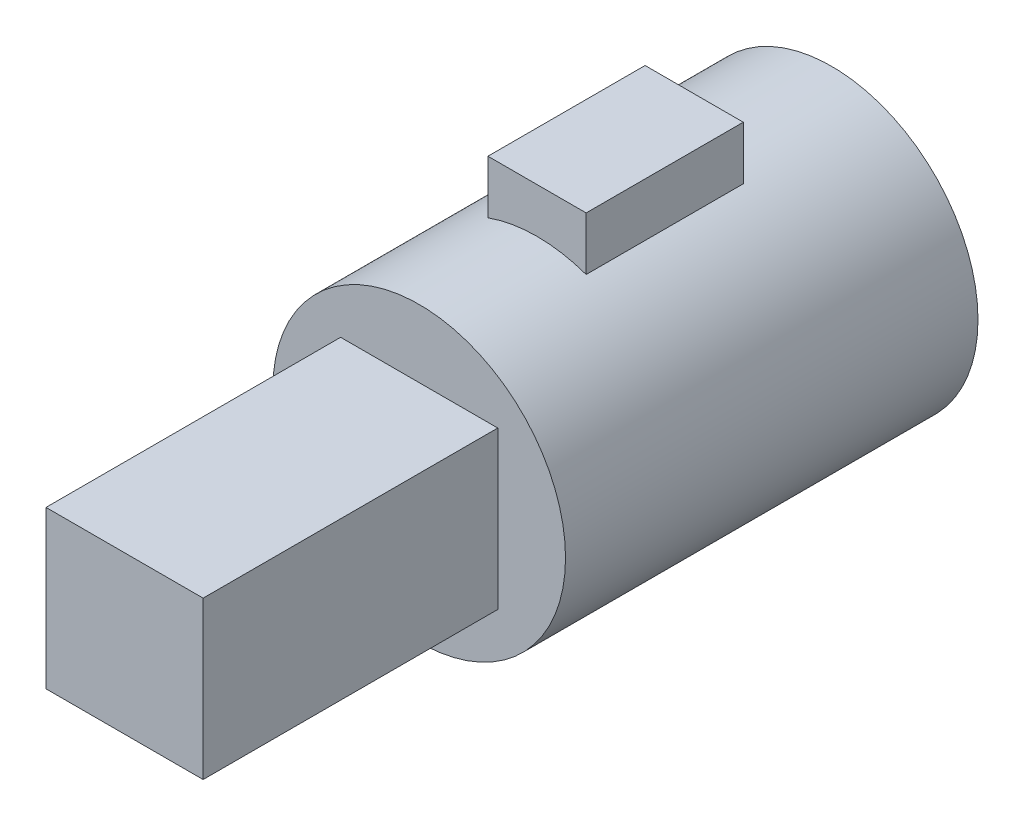
from build123d import *

# Parameters (mm, degrees)
SKETCH1_R           = 7.45
BOSS_EXTRUDE1_DEPTH = 21
BOSS_EXTRUDE4_START = -7
SKETCH4_W           = 5
SKETCH4_H           = 9.734089582
BOSS_EXTRUDE4_DEPTH = 8
SKETCH5_W           = 8
SKETCH5_H           = 8
BOSS_EXTRUDE5_DEPTH = 15


with BuildPart() as part:
    # Sketch1 → Boss-Extrude1 (new body)
    with BuildSketch(Plane.XY):
        with Locations(Location((0, 0, 0), (0, 0, 180))):
            Circle(SKETCH1_R)
    extrude(amount=BOSS_EXTRUDE1_DEPTH)

    # Sketch4 → Boss-Extrude4 (add)
    with BuildSketch(Plane(origin=(0, 0, 0), x_dir=(-1, 0, 0), z_dir=(0, 0, -1)).offset(BOSS_EXTRUDE4_START)):
        with Locations((0, 4.867044791)):
            Rectangle(SKETCH4_W, SKETCH4_H)
    extrude(amount=-BOSS_EXTRUDE4_DEPTH)

    # Sketch5 → Boss-Extrude5 (add)
    with BuildSketch(Plane.XY.offset(21)):
        Rectangle(SKETCH5_W, SKETCH5_H)
    extrude(amount=BOSS_EXTRUDE5_DEPTH)


solid = part.part
